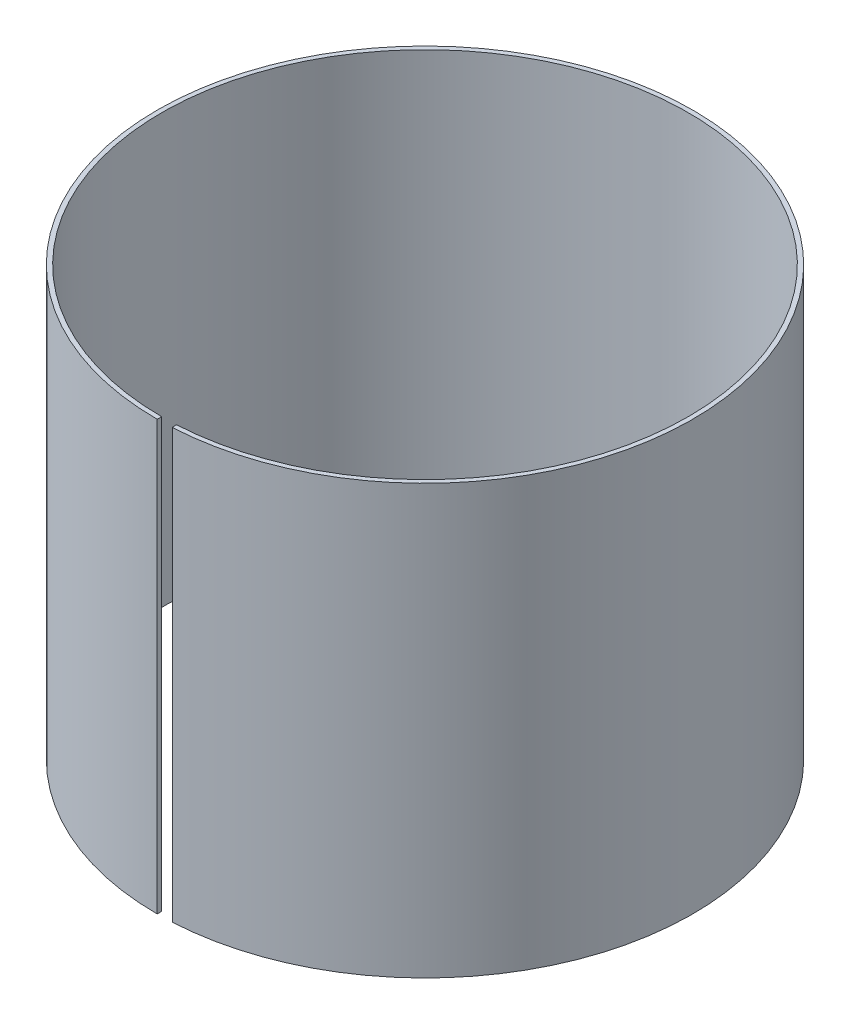
from build123d import *

# Parameters (mm, degrees)
EXTRUDE_THIN2_DEPTH = 48


with BuildPart() as part:
    # Sketch79 → Extrude-Thin2 (new body)
    with BuildSketch(Plane(origin=(0, 0, 0), x_dir=(1, 0, 0), z_dir=(0, 1, 0))):
        with BuildLine():
            ThreePointArc((0, -29.5), (-0.806356217, 29.488977426), (1.612109849, -29.455917942))
            Line((1.612109849, -29.455917942), (1.639433745, -29.955170789))
            ThreePointArc((1.639433745, -29.955170789), (-0.820023271, 29.988790603), (0, -30))
            Line((0, -30), (0, -29.5))
        make_face()
    extrude(amount=EXTRUDE_THIN2_DEPTH)


solid = part.part
